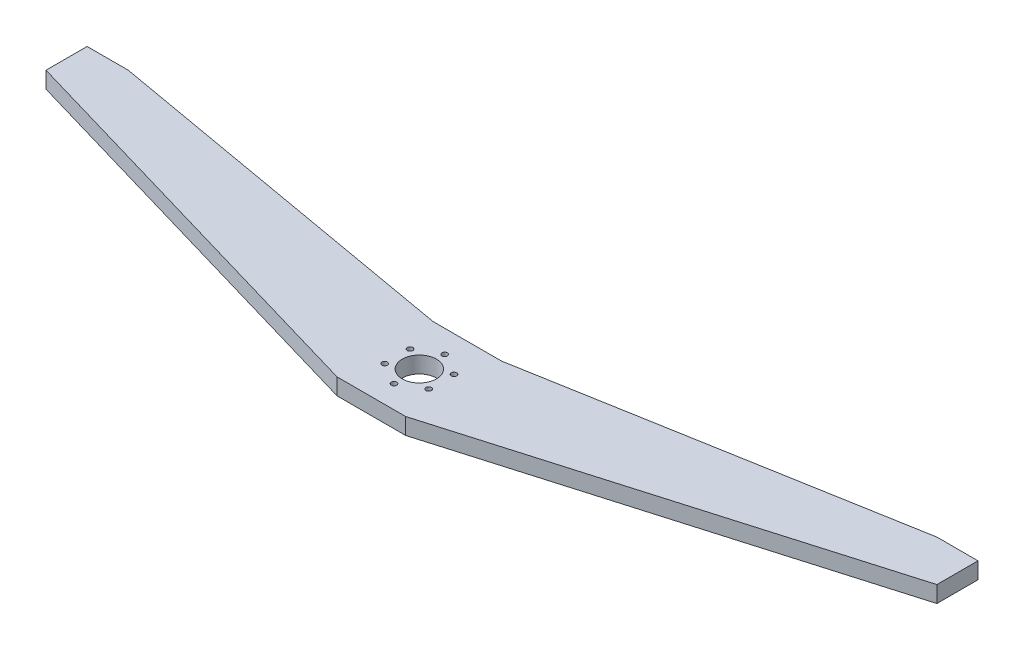
from build123d import *

# Parameters (mm, degrees)
BOSS_EXTRUDE1_DEPTH = 12
SKETCH4_R           = 12.5
SKETCH4_R_2         = 2
CUT_EXTRUDE1_DEPTH  = 20


with BuildPart() as part:
    # Sketch2 → Boss-Extrude1 (new body)
    with BuildSketch(Plane(origin=(0, 0, 0), x_dir=(1, 0, 0), z_dir=(0, 1, 0))):
        Polygon((-318.206861599, 87.608284791), (-18.206861599, 0), (31.793138401, 0), (331.793138401, 87.608284791), (331.793138401, 117.608284791), (301.793138401, 117.608284791), (31.793138401, 70), (-18.206861599, 70), (-288.206861599, 117.608284791), (-318.206861599, 117.608284791), align=None)
    extrude(amount=BOSS_EXTRUDE1_DEPTH)

    # Sketch4 → Cut-Extrude1 (cut)
    with BuildSketch(Plane(origin=(0, 12, 0), x_dir=(1, 0, 0), z_dir=(0, 1, 0))):
        with Locations(Location((6.793138401, 35, 0), (0, 0, 270))):
            Circle(SKETCH4_R)
        with Locations(Location((6.793138401, 53.5, 0), (0, 0, 270))):
            Circle(SKETCH4_R_2)
        with Locations(Location((22.814608371, 44.25, 0), (0, 0, 270))):
            Circle(SKETCH4_R_2)
        with Locations(Location((22.814608371, 25.75, 0), (0, 0, 270))):
            Circle(SKETCH4_R_2)
        with Locations(Location((6.793138401, 16.5, 0), (0, 0, 270))):
            Circle(SKETCH4_R_2)
        with Locations(Location((-9.228331569, 25.75, 0), (0, 0, 270))):
            Circle(SKETCH4_R_2)
        with Locations(Location((-9.228331569, 44.25, 0), (0, 0, 270))):
            Circle(SKETCH4_R_2)
    extrude(amount=-CUT_EXTRUDE1_DEPTH, mode=Mode.SUBTRACT)


solid = part.part
